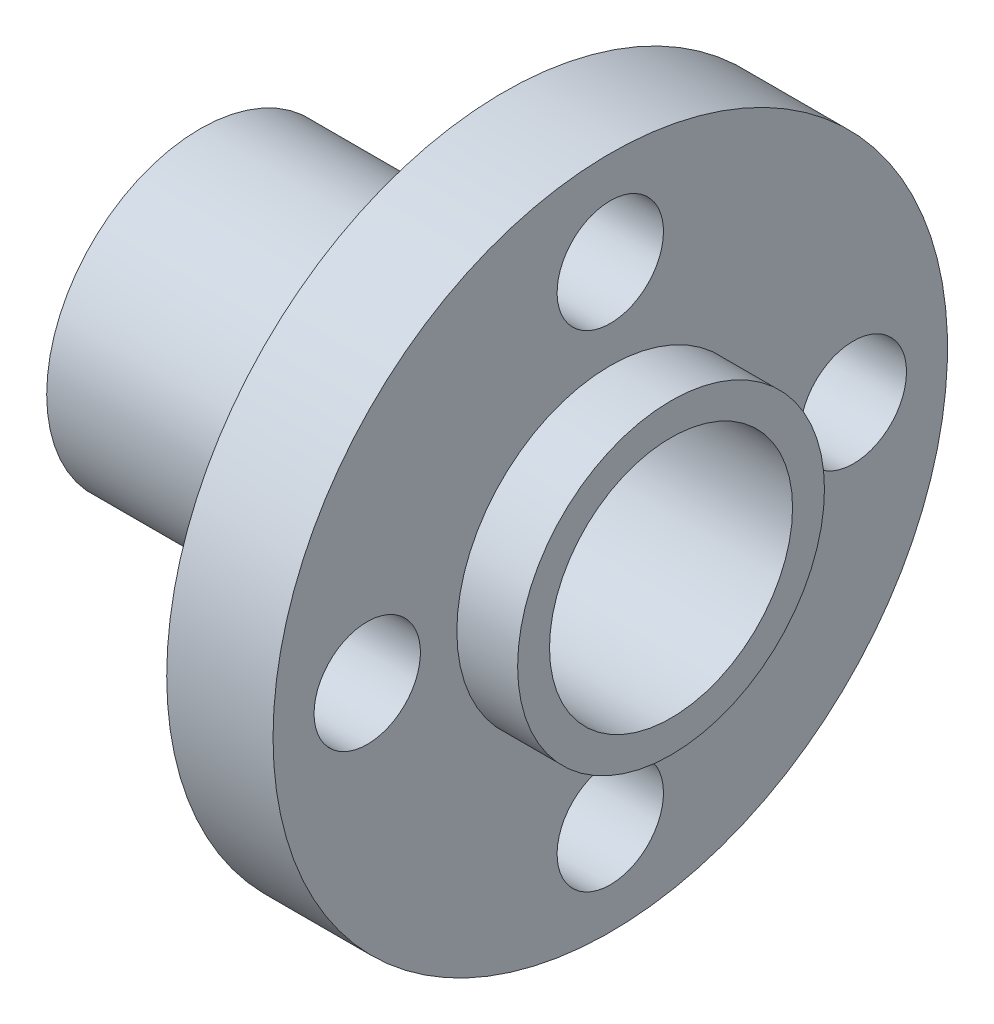
from build123d import *

# Parameters (mm, degrees)
SKETCH1_W          = 3.5
SKETCH1_H          = 6.05
SKETCH1_W_2        = 15.5
SKETCH1_H_2        = 1.05
SKETCH2_R          = 1.75
CUT_EXTRUDE1_DEPTH = 23.06059836
CIRPATTERN1_COUNT  = 4


with BuildPart() as part:
    # Sketch1 → Revolve1 (revolve)
    with BuildSketch(Plane.XY, mode=Mode.PRIVATE) as revolve1_sk:
        with Locations((11.75, 8.075)):
            Rectangle(SKETCH1_W, SKETCH1_H)
        with Locations((7.75, 4.525)):
            Rectangle(SKETCH1_W_2, SKETCH1_H_2)
    revolve(revolve1_sk.sketch.rotate(Axis((0, 0, 0), (1, 0, 0)), 90), axis=Axis((0, 0, 0), (1, 0, 0)))

    # Sketch2 → Cut-Extrude1 (cut, through all)
    with BuildSketch(Plane(origin=(0, 0, 0), x_dir=(0, 0, -1), z_dir=(1, 0, 0))):
        with Locations((8, 0)):
            Circle(SKETCH2_R)
    cut_extrude1 = extrude(amount=CUT_EXTRUDE1_DEPTH, mode=Mode.SUBTRACT)

    # CirPattern1: Cut-Extrude1 ×4 about axis
    cirpattern1_axis = Axis((0, 0, 0), (1, 0, 0))
    for i in range(1, CIRPATTERN1_COUNT):
        add(cut_extrude1.rotate(cirpattern1_axis, i * 360 / CIRPATTERN1_COUNT), mode=Mode.SUBTRACT)


solid = part.part
